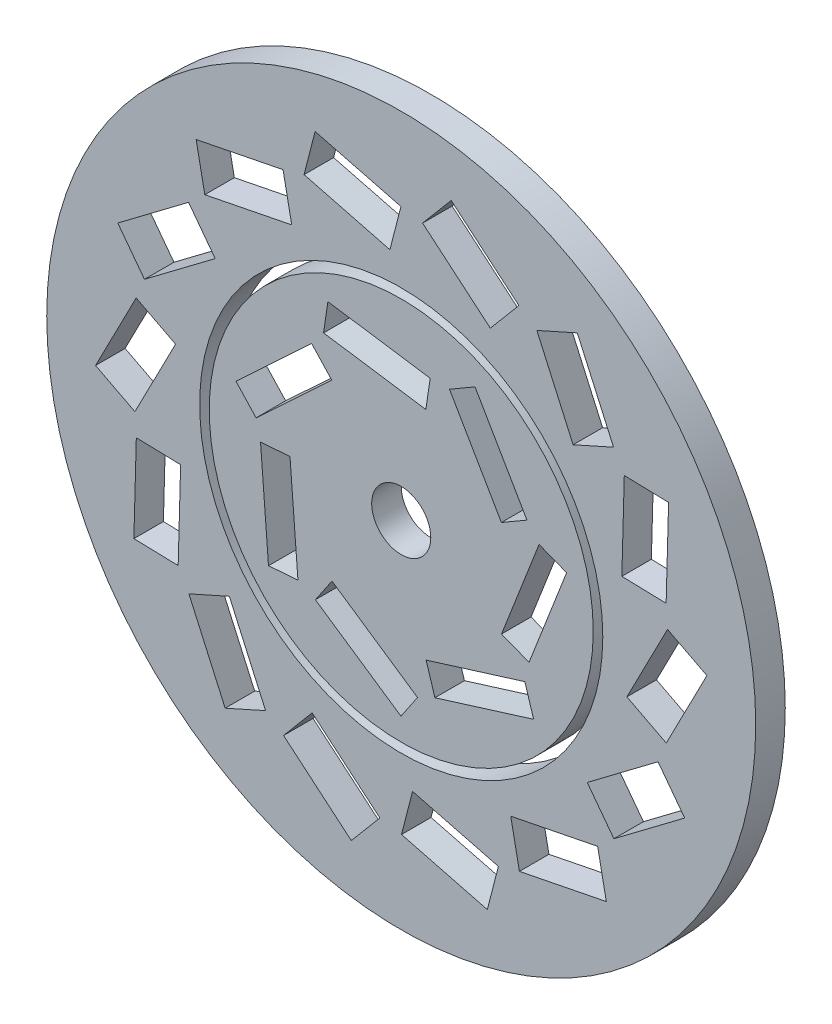
from build123d import *

# Parameters (mm, degrees)
SKETCH1_R             = 120
SKETCH1_R_2           = 68.233940928
BOSS_EXTRUDE1_DEPTH   = 10
SKETCH1_R_3           = 65
SKETCH1_R_4           = 10
BOSS_EXTRUDE1_2_DEPTH = 10


with BuildPart() as part:
    # Sketch1 → Boss-Extrude1 (new body)
    with BuildSketch(Plane.XY):
        Circle(SKETCH1_R)
        Circle(SKETCH1_R_2, mode=Mode.SUBTRACT)
        Polygon((58.179164054, 51.301559926), (45.915256889, 78.680321422), (59.604637637, 84.812275004), (71.868544802, 57.433513508), align=None, mode=Mode.SUBTRACT)
        Polygon((75.506329072, 50.966636776), (90.500589895, 50.551736348), (89.670789039, 20.563214701), (74.676528216, 20.978115129), align=None, mode=Mode.SUBTRACT)
        Polygon((90.142446758, 13.158384652), (103.471790408, 6.278806332), (89.712633768, -20.379880968), (76.383290118, -13.500302648), align=None, mode=Mode.SUBTRACT)
        Polygon((86.924747339, -27.256046929), (95.949133832, -39.237718283), (71.985791125, -57.286491269), (62.961404632, -45.304819915), align=None, mode=Mode.SUBTRACT)
        Polygon((66.490535648, -62.272084143), (69.422574562, -76.982731573), (40.001279702, -82.846809401), (37.069240788, -68.136161971), align=None, mode=Mode.SUBTRACT)
        Polygon((32.887057918, -84.954371375), (29.146022988, -99.480370743), (0.094024251, -91.998300882), (3.835059181, -77.472301514), align=None, mode=Mode.SUBTRACT)
        Polygon((-7.230104965, -90.810403459), (-16.903255892, -102.274702441), (-39.831853856, -82.928400589), (-30.15870293, -71.464101606), align=None, mode=Mode.SUBTRACT)
        Polygon((-45.915256889, -78.680321422), (-59.604637637, -84.812275004), (-71.868544802, -57.433513508), (-58.179164054, -51.301559926), align=None, mode=Mode.SUBTRACT)
        Polygon((-75.506329072, -50.966636776), (-90.500589895, -50.551736348), (-89.670789039, -20.563214701), (-74.676528216, -20.978115129), align=None, mode=Mode.SUBTRACT)
        Polygon((-90.142446758, -13.158384652), (-103.471790408, -6.278806332), (-89.712633768, 20.379880968), (-76.383290118, 13.500302648), align=None, mode=Mode.SUBTRACT)
        Polygon((-86.924747339, 27.256046929), (-95.949133832, 39.237718283), (-71.985791125, 57.286491269), (-62.961404632, 45.304819915), align=None, mode=Mode.SUBTRACT)
        Polygon((-66.490535648, 62.272084143), (-69.422574562, 76.982731573), (-40.001279702, 82.846809401), (-37.069240788, 68.136161971), align=None, mode=Mode.SUBTRACT)
        Polygon((-32.887057918, 84.954371375), (-29.146022988, 99.480370743), (-0.094024251, 91.998300882), (-3.835059181, 77.472301514), align=None, mode=Mode.SUBTRACT)
        Polygon((7.230104965, 90.810403459), (16.903255892, 102.274702441), (39.831853856, 82.928400589), (30.15870293, 71.464101606), align=None, mode=Mode.SUBTRACT)
    extrude(amount=BOSS_EXTRUDE1_DEPTH)


with BuildPart() as body_2:
    # Sketch1 → Boss-Extrude1 2 (new body)
    with BuildSketch(Plane.XY):
        Circle(SKETCH1_R_3)
        Circle(SKETCH1_R_4, mode=Mode.SUBTRACT)
        Polygon((24.986251453, 51.67388548), (42.554599527, 21.402560006), (33.905649392, 16.383031985), (16.337301318, 46.654357459), align=None, mode=Mode.SUBTRACT)
        Polygon((46.661986217, 16.315499579), (33.948596805, -16.293850762), (43.265554046, -19.926247737), (55.978943458, 12.683102604), align=None, mode=Mode.SUBTRACT)
        Polygon((41.849243764, -26.309262259), (8.427558399, -36.701131551), (11.396663911, -46.250184513), (44.818349276, -35.858315221), align=None, mode=Mode.SUBTRACT)
        Polygon((5.523167187, -49.122613005), (-23.439603373, -29.471711716), (-29.054146598, -37.746789018), (-0.091376038, -57.397690308), align=None, mode=Mode.SUBTRACT)
        Polygon((-34.961966933, -34.945634239), (-37.656265724, -0.049491845), (-47.626592122, -0.819291499), (-44.932293332, -35.715433894), align=None, mode=Mode.SUBTRACT)
        Polygon((-49.120026859, 5.54611987), (-23.516991937, 29.409996395), (-30.335242373, 36.725149229), (-55.938277295, 12.861272705), align=None, mode=Mode.SUBTRACT)
        Polygon((-26.289704694, 41.861532597), (8.331056437, 36.723157494), (9.799163609, 46.614803532), (-24.821597522, 51.753178634), align=None, mode=Mode.SUBTRACT)
    extrude(amount=BOSS_EXTRUDE1_2_DEPTH)


solid = Compound([part.part, body_2.part])
